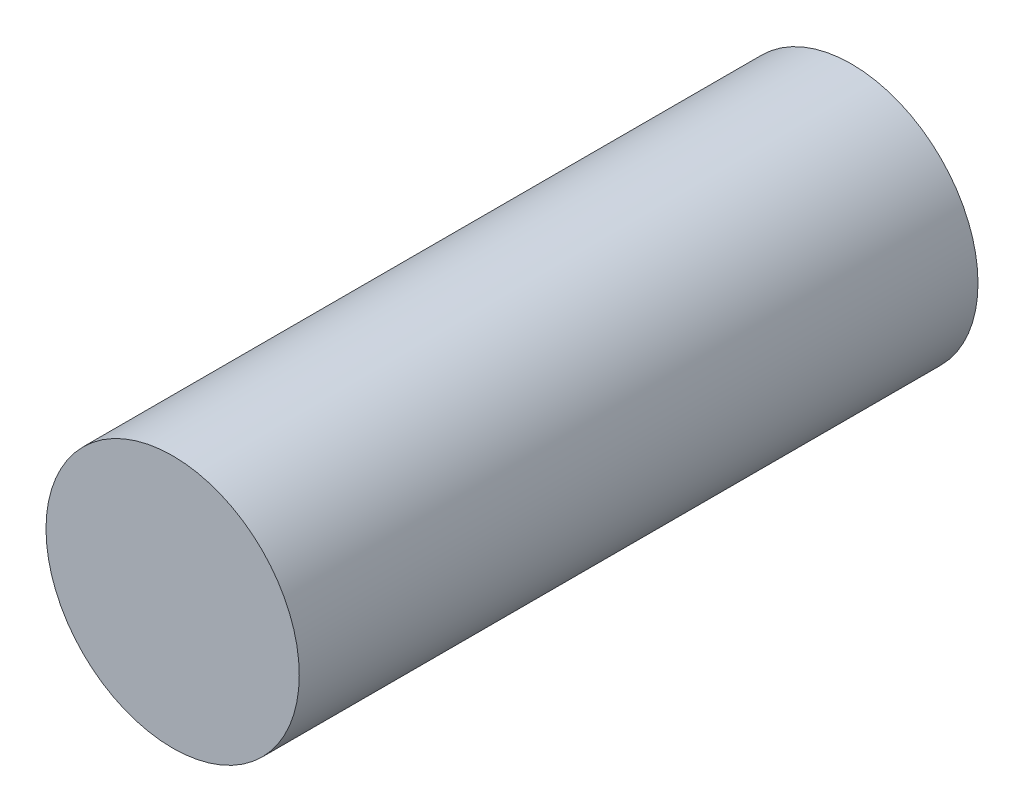
from build123d import *

# Parameters (mm, degrees)
BODY_SKETCH_R = 2.5
BODY_DEPTH    = 13.4


with BuildPart() as part:
    # Body sketch → Body (new body)
    with BuildSketch(Plane.XY):
        Circle(BODY_SKETCH_R)
    extrude(amount=BODY_DEPTH)


solid = part.part
